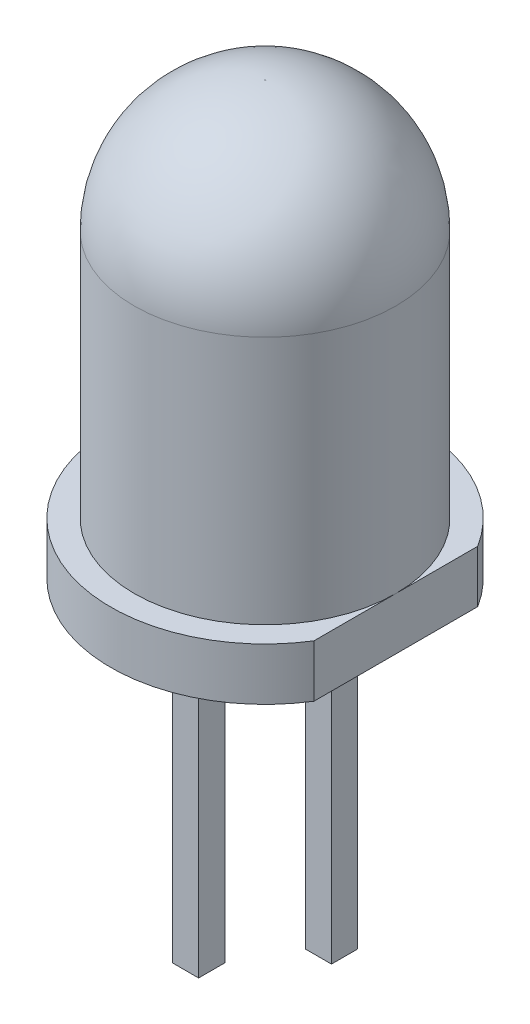
from build123d import *

# Parameters (mm, degrees)
CROQUIS1_R           = 2.95
BASE_DEPTH           = 1
CROQUIS2_R           = 2.5
CUERPO_DEL_LED_DEPTH = 7.25
CROQUIS3_W           = 0.5
CROQUIS3_H           = 0.5
PINES_DEPTH          = 7
CROQUIS4_W           = 0.5
CROQUIS4_H           = 0.5
CORTE_A_CATODO_DEPTH = 1.5
REDONDEO_A_ANODO_R   = 0.5
REDONDEO_A_CATODO_R  = 0.5
CROQUIS6_W           = 1
CROQUIS6_H           = 6
RANURA_DEPTH         = 1
PUNTA_DEL_LED_R      = 2.49


with BuildPart() as part:
    # Croquis1 → Base (new body)
    with BuildSketch(Plane(origin=(0, 0, 0), x_dir=(1, 0, 0), z_dir=(0, 1, 0))):
        with Locations(Location((0, 0, 0), (0, 0, 270))):
            Circle(CROQUIS1_R)
    extrude(amount=BASE_DEPTH)

    # Croquis2 → Cuerpo del LED (add)
    with BuildSketch(Plane(origin=(0, 1, 0), x_dir=(1, 0, 0), z_dir=(0, 1, 0))):
        with Locations(Location((0, 0, 0), (0, 0, 90))):
            Circle(CROQUIS2_R)
    extrude(amount=CUERPO_DEL_LED_DEPTH)

    # Croquis3 → Pines (add)
    with BuildSketch(Plane.XZ):
        with Locations((-1.270142923, 0)):
            Rectangle(CROQUIS3_W, CROQUIS3_H)
        with Locations((1.270172723, 0)):
            Rectangle(CROQUIS3_W, CROQUIS3_H)
    extrude(amount=PINES_DEPTH)

    # Croquis4 → Corte a Catodo (cut)
    with BuildSketch(Plane.XZ.offset(7)):
        with Locations((1.270172723, 0)):
            Rectangle(CROQUIS4_W, CROQUIS4_H)
    extrude(amount=-CORTE_A_CATODO_DEPTH, mode=Mode.SUBTRACT)

    # Redondeo a Anodo
    redondeo_a_anodo_edges = [part.edges().sort_by_distance(p)[0] for p in [
        (-1.520142923, 0, 0),
        (-1.270142923, 0, -0.25),
        (-1.020142923, 0, 0),
        (-1.270142923, 0, 0.25),
    ]]
    fillet(redondeo_a_anodo_edges, radius=REDONDEO_A_ANODO_R)

    # Redondeo a Catodo
    redondeo_a_catodo_edges = [part.edges().sort_by_distance(p)[0] for p in [
        (1.020172723, 0, 0),
        (1.270172723, 0, -0.25),
        (1.520172723, 0, 0),
        (1.270172723, 0, 0.25),
    ]]
    fillet(redondeo_a_catodo_edges, radius=REDONDEO_A_CATODO_R)

    # Croquis6 → Ranura (cut)
    with BuildSketch(Plane(origin=(0, 1, 0), x_dir=(1, 0, 0), z_dir=(0, 1, 0))):
        with Locations((3, -0.26955261)):
            Rectangle(CROQUIS6_W, CROQUIS6_H)
    extrude(amount=-RANURA_DEPTH, mode=Mode.SUBTRACT)

    # Punta del Led
    punta_del_led_edges = [part.edges().sort_by_distance(p)[0] for p in [
        (0, 8.25, 2.5),
    ]]
    fillet(punta_del_led_edges, radius=PUNTA_DEL_LED_R)


solid = part.part
